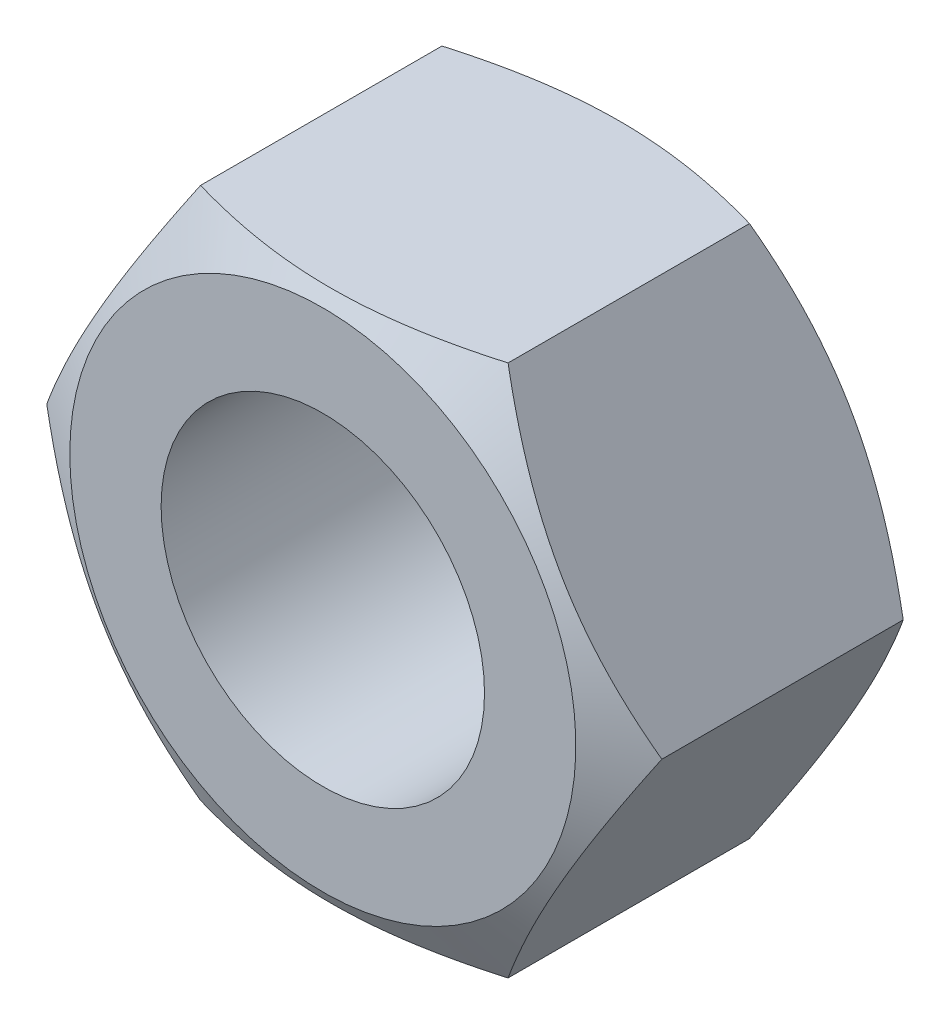
from build123d import *

# Parameters (mm, degrees)
BASENUTSKE_R            = 4.25
BASENUT_DEPTH           = 8
SKETCH6_OUTSIDE_W       = 72.456
SKETCH6_OUTSIDE_H       = 70.29
SKETCH6_OUTSIDE_R       = 6.65
CUT_EXTRUDE2_DEPTH      = 14.354150416
CUT_EXTRUDE2_DRAFT      = -60
MIRROR1_COPY_1_SKETCH_W = 72.456
MIRROR1_COPY_1_SKETCH_H = 70.29
MIRROR1_COPY_1_SKETCH_R = 6.65
MIRROR1_COPY_1_DEPTH    = 14.354150416
MIRROR1_COPY_1_DRAFT    = -60


with BuildPart() as part:
    # BaseNutSke → BaseNut (new body)
    with BuildSketch(Plane.XY):
        Polygon((4.041451884, -7), (-4.041451884, -7), (-8.082903769, 0), (-4.041451884, 7), (4.041451884, 7), (8.082903769, 0), align=None)
        Circle(BASENUTSKE_R, mode=Mode.SUBTRACT)
    extrude(amount=-BASENUT_DEPTH)


with BuildPart() as cut_extrude2_tool:
    # Sketch6 outside → Cut-Extrude2 (with draft: the straight prism first)
    with BuildSketch(Plane(origin=(0, 0, -8), x_dir=(-1, 0, 0), z_dir=(0, 0, -1))):
        Rectangle(SKETCH6_OUTSIDE_W, SKETCH6_OUTSIDE_H)
        Circle(SKETCH6_OUTSIDE_R, mode=Mode.SUBTRACT)
    extrude(amount=-CUT_EXTRUDE2_DEPTH)
    # Cut-Extrude2: the draft: its side faces are tilted about the plane it starts from
    cut_extrude2_sides = [cut_extrude2_tool.faces().sort_by_distance(p)[0] for p in [
        (0, -35.145, -0.822924792),
        (-36.228, 0, -0.822924792),
        (0, 35.145, -0.822924792),
        (36.228, 0, -0.822924792),
        (6.65, 0, -0.822924792),
    ]]
    draft(cut_extrude2_sides, Plane(origin=(0, 0, -8), x_dir=(-1, 0, 0), z_dir=(0, 0, -1)), CUT_EXTRUDE2_DRAFT)


with BuildPart() as part_1:
    add(part.part)

    # Cut-Extrude2: cut by cut_extrude2_tool
    add(cut_extrude2_tool.part, mode=Mode.SUBTRACT)


with BuildPart() as mirror1_copy_1_tool:
    # Mirror1 copy 1 sketch → Mirror1 copy 1 (with draft: the straight prism first)
    with BuildSketch(Plane(origin=(0, 0, 0), x_dir=(-1, 0, 0), z_dir=(0, 0, 1))):
        Rectangle(MIRROR1_COPY_1_SKETCH_W, MIRROR1_COPY_1_SKETCH_H)
        Circle(MIRROR1_COPY_1_SKETCH_R, mode=Mode.SUBTRACT)
    extrude(amount=-MIRROR1_COPY_1_DEPTH)
    # Mirror1 copy 1: the draft: its side faces are tilted about the plane it starts from
    mirror1_copy_1_sides = [mirror1_copy_1_tool.faces().sort_by_distance(p)[0] for p in [
        (0, -35.145, -7.177075208),
        (-36.228, 0, -7.177075208),
        (0, 35.145, -7.177075208),
        (36.228, 0, -7.177075208),
        (6.65, 0, -7.177075208),
    ]]
    draft(mirror1_copy_1_sides, Plane(origin=(0, 0, 0), x_dir=(-1, 0, 0), z_dir=(0, 0, 1)), MIRROR1_COPY_1_DRAFT)


with BuildPart() as part_2:
    add(part_1.part)

    # Mirror1 copy 1: cut by mirror1_copy_1_tool
    add(mirror1_copy_1_tool.part, mode=Mode.SUBTRACT)


solid = part_2.part
